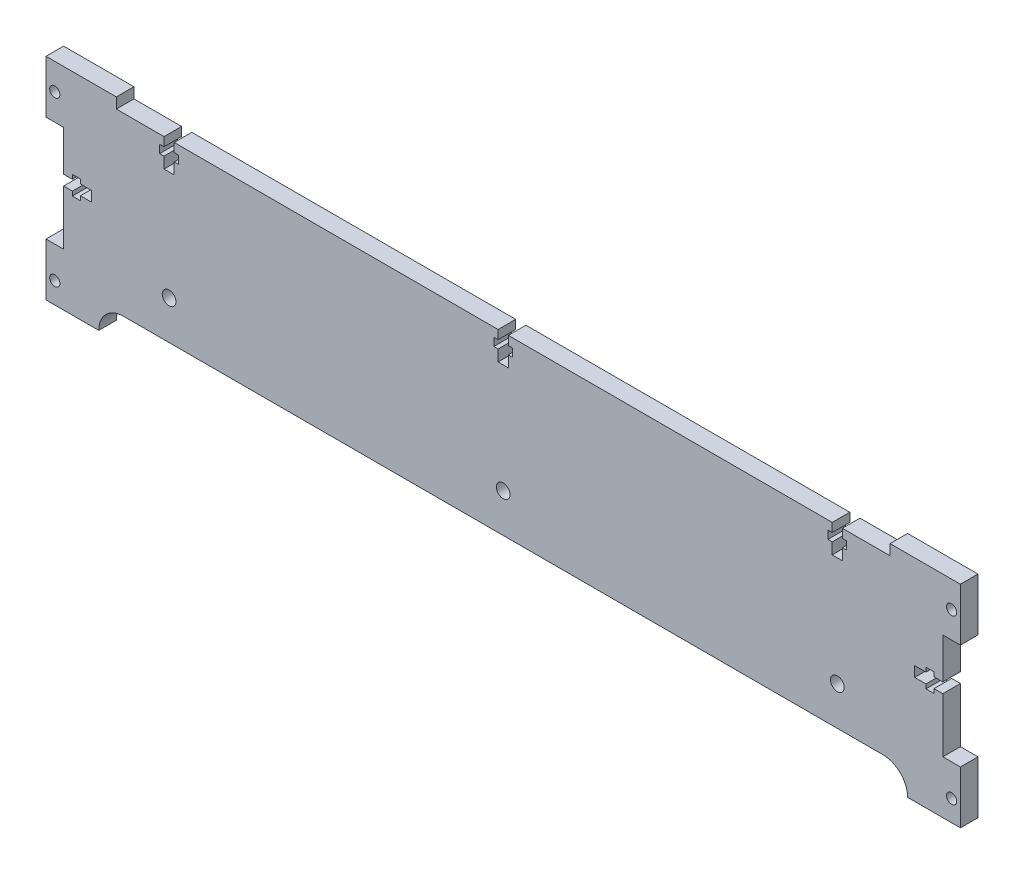
from build123d import *

# Parameters (mm, degrees)
BOSS_EXTRUDE1_DEPTH = 5
SKETCH2_R           = 1.45
CUT_EXTRUDE1_DEPTH  = 140.73546436
SKETCH3_R           = 1.95
CUT_EXTRUDE2_DEPTH  = 140.73546436


with BuildPart() as part:
    # Sketch1 → Boss-Extrude1 (new body)
    with BuildSketch(Plane.XY):
        with BuildLine():
            Line((130, 6), (125, 6))
            Line((125, 6), (125, 21.55))
            Line((125, 21.55), (122.5, 21.55))
            Line((122.5, 21.55), (122.5, 20.325))
            Line((122.5, 20.325), (120.2, 20.325))
            Line((120.2, 20.325), (120.2, 21.55))
            Line((120.2, 21.55), (117, 21.55))
            Line((117, 21.55), (117, 24.45))
            Line((117, 24.45), (120.2, 24.45))
            Line((120.2, 24.45), (120.2, 25.675))
            Line((120.2, 25.675), (122.5, 25.675))
            Line((122.5, 25.675), (122.5, 24.45))
            Line((122.5, 24.45), (125, 24.45))
            Line((125, 24.45), (125, 36))
            Line((125, 36), (130, 36))
            Line((130, 36), (130, 51))
            Line((130, 51), (110, 51))
            Line((110, 51), (110, 48))
            Line((110, 48), (96.45, 48))
            Line((96.45, 48), (96.45, 45.5))
            Line((96.45, 45.5), (97.675, 45.5))
            Line((97.675, 45.5), (97.675, 43.2))
            Line((97.675, 43.2), (96.45, 43.2))
            Line((96.45, 43.2), (96.45, 40))
            Line((96.45, 40), (93.55, 40))
            Line((93.55, 40), (93.55, 43.2))
            Line((93.55, 43.2), (92.325, 43.2))
            Line((92.325, 43.2), (92.325, 45.5))
            Line((92.325, 45.5), (93.55, 45.5))
            Line((93.55, 45.5), (93.55, 48))
            Line((93.55, 48), (1.45, 48))
            Line((1.45, 48), (1.45, 45.5))
            Line((1.45, 45.5), (2.675, 45.5))
            Line((2.675, 45.5), (2.675, 43.2))
            Line((2.675, 43.2), (1.45, 43.2))
            Line((1.45, 43.2), (1.45, 40))
            Line((1.45, 40), (-1.45, 40))
            Line((-1.45, 40), (-1.45, 43.2))
            Line((-1.45, 43.2), (-2.675, 43.2))
            Line((-2.675, 43.2), (-2.675, 45.5))
            Line((-2.675, 45.5), (-1.45, 45.5))
            Line((-1.45, 45.5), (-1.45, 48))
            Line((-1.45, 48), (-93.55, 48))
            Line((-93.55, 48), (-93.55, 45.5))
            Line((-93.55, 45.5), (-92.325, 45.5))
            Line((-92.325, 45.5), (-92.325, 43.2))
            Line((-92.325, 43.2), (-93.55, 43.2))
            Line((-93.55, 43.2), (-93.55, 40))
            Line((-93.55, 40), (-96.45, 40))
            Line((-96.45, 40), (-96.45, 43.2))
            Line((-96.45, 43.2), (-97.675, 43.2))
            Line((-97.675, 43.2), (-97.675, 45.5))
            Line((-97.675, 45.5), (-96.45, 45.5))
            Line((-96.45, 45.5), (-96.45, 48))
            Line((-96.45, 48), (-110, 48))
            Line((-110, 48), (-110, 51))
            Line((-110, 51), (-130, 51))
            Line((-130, 51), (-130, 36))
            Line((-130, 36), (-125, 36))
            Line((-125, 36), (-125, 24.45))
            Line((-125, 24.45), (-122.5, 24.45))
            Line((-122.5, 24.45), (-122.5, 25.675))
            Line((-122.5, 25.675), (-120.2, 25.675))
            Line((-120.2, 25.675), (-120.2, 24.45))
            Line((-120.2, 24.45), (-117, 24.45))
            Line((-117, 24.45), (-117, 21.55))
            Line((-117, 21.55), (-120.2, 21.55))
            Line((-120.2, 21.55), (-120.2, 20.325))
            Line((-120.2, 20.325), (-122.5, 20.325))
            Line((-122.5, 20.325), (-122.5, 21.55))
            Line((-122.5, 21.55), (-125, 21.55))
            Line((-125, 21.55), (-125, 6))
            Line((-125, 6), (-130, 6))
            Line((-130, 6), (-130, -9))
            Line((-130, -9), (-115, -9))
            ThreePointArc((-115, -9), (-112.949747468, -4.050252532), (-108, -2))
            Line((-108, -2), (108, -2))
            ThreePointArc((108, -2), (112.949747468, -4.050252532), (115, -9))
            Line((115, -9), (130, -9))
            Line((130, -9), (130, 6))
        make_face()
    extrude(amount=BOSS_EXTRUDE1_DEPTH)

    # Sketch2 → Cut-Extrude1 (cut, through all)
    with BuildSketch(Plane.XY.offset(5)):
        with Locations((-127.5, 43.5)):
            Circle(SKETCH2_R)
        with Locations((-127.5, -3)):
            Circle(SKETCH2_R)
        with Locations((127.5, -3)):
            Circle(SKETCH2_R)
        with Locations((127.5, 43.5)):
            Circle(SKETCH2_R)
    extrude(amount=-CUT_EXTRUDE1_DEPTH, mode=Mode.SUBTRACT)

    # Sketch3 → Cut-Extrude2 (cut, through all)
    with BuildSketch(Plane.XY.offset(5)):
        with Locations((0, 9)):
            Circle(SKETCH3_R)
        with Locations((-95, 9)):
            Circle(SKETCH3_R)
        with Locations((95, 9)):
            Circle(SKETCH3_R)
    extrude(amount=-CUT_EXTRUDE2_DEPTH, mode=Mode.SUBTRACT)


solid = part.part
